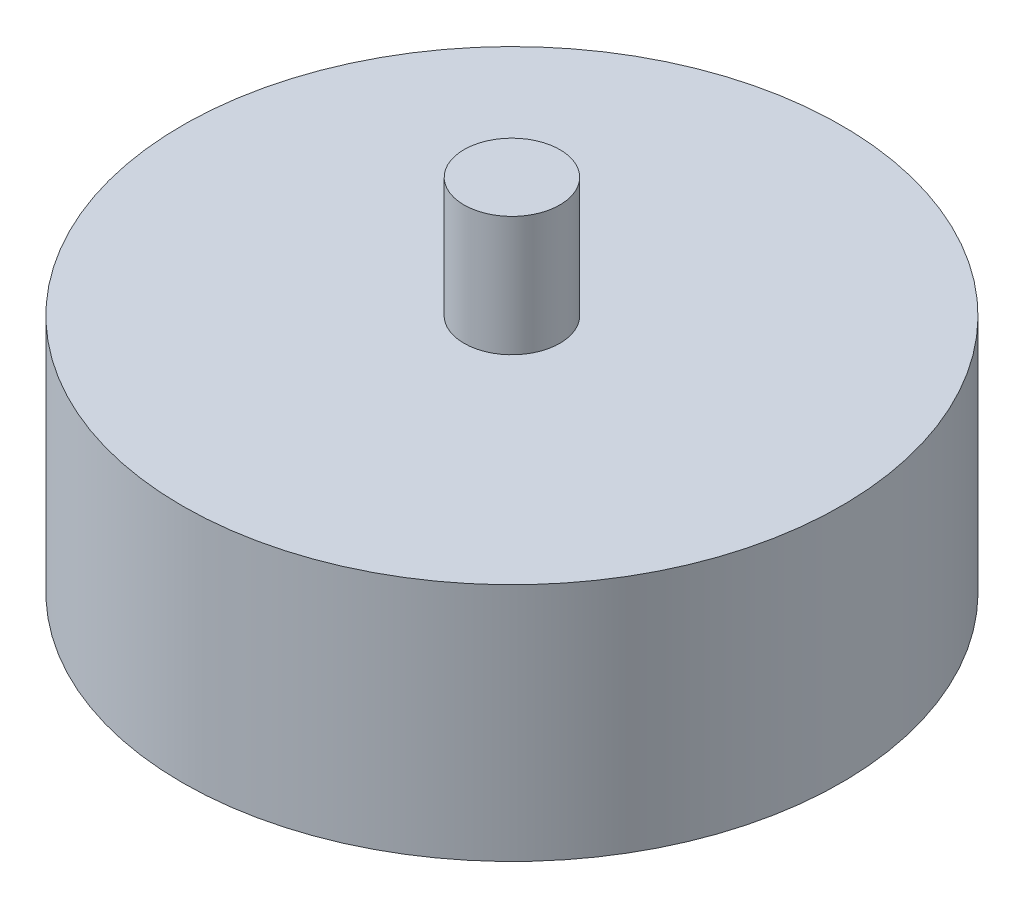
from build123d import *

# Parameters (mm, degrees)
SKETCH_1_R      = 27.5
EXTRUDE_1_DEPTH = 20
SKETCH_2_R      = 4
EXTRUDE_2_DEPTH = 10


with BuildPart() as part:
    # 草图1 → 凸台-拉伸1 (new body)
    with BuildSketch(Plane(origin=(0, 0, 0), x_dir=(1, 0, 0), z_dir=(0, 1, 0))):
        with Locations(Location((0, 0, 0), (0, 0, 270))):
            Circle(SKETCH_1_R)
    extrude(amount=EXTRUDE_1_DEPTH)

    # 草图2 → 凸台-拉伸2 (add)
    with BuildSketch(Plane(origin=(0, 20, 0), x_dir=(1, 0, 0), z_dir=(0, 1, 0))):
        with Locations(Location((0, 0, 0), (0, 0, 270))):
            Circle(SKETCH_2_R)
    extrude(amount=EXTRUDE_2_DEPTH)


solid = part.part
